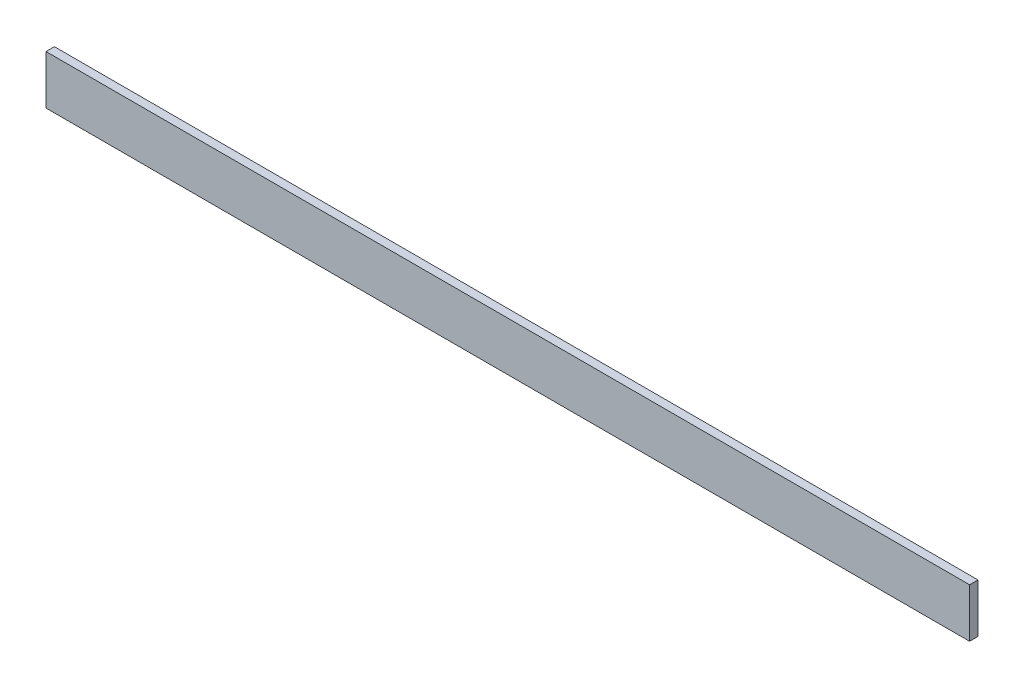
from build123d import *

# Parameters (mm, degrees)
SKETCH1_W           = 660
SKETCH1_H           = 35
BOSS_EXTRUDE1_DEPTH = 6


with BuildPart() as part:
    # Sketch1 → Boss-Extrude1 (new body)
    with BuildSketch(Plane.XY):
        with Locations((230.495867769, -8.326446281)):
            Rectangle(SKETCH1_W, SKETCH1_H)
    extrude(amount=BOSS_EXTRUDE1_DEPTH)


solid = part.part
